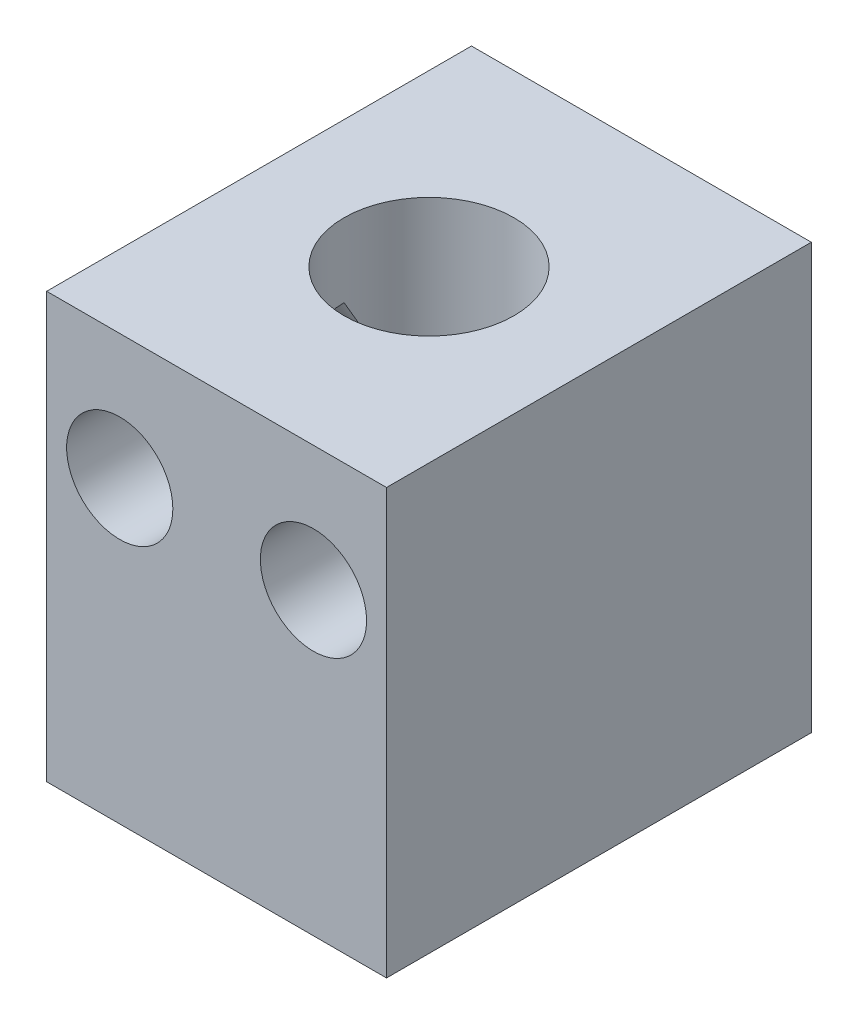
from build123d import *

# Parameters (mm, degrees)
ESQUISSE1_W           = 8
ESQUISSE1_H           = 10
ESQUISSE1_R           = 2
BOSS_EXTRU_1_DEPTH    = 10
TROU_TARAUD_M31_D     = 2.5
TROU_TARAUD_M31_DEPTH = 5
TROU_TARAUD_M31_TIP   = 0.751075774


with BuildPart() as part:
    # Esquisse1 → Boss.-Extru.1 (new body)
    with BuildSketch(Plane(origin=(0, 0, 0), x_dir=(1, 0, 0), z_dir=(0, 1, 0))):
        Rectangle(ESQUISSE1_W, ESQUISSE1_H)
        with Locations(Location((0, 0, 0), (0, 0, 270))):
            Circle(ESQUISSE1_R, mode=Mode.SUBTRACT)
    extrude(amount=BOSS_EXTRU_1_DEPTH)

    # Trou taraudé M31
    with Locations(Plane.XY.offset(5)):
        with Locations((-2.280208153, 7.049723064), (2.280208153, 7.049723064)):
            Hole(TROU_TARAUD_M31_D / 2, depth=TROU_TARAUD_M31_DEPTH)
            with Locations((0, 0, -(TROU_TARAUD_M31_DEPTH + TROU_TARAUD_M31_TIP / 2))):  # 118° drill point
                Cone(0, TROU_TARAUD_M31_D / 2, TROU_TARAUD_M31_TIP, mode=Mode.SUBTRACT)


solid = part.part
